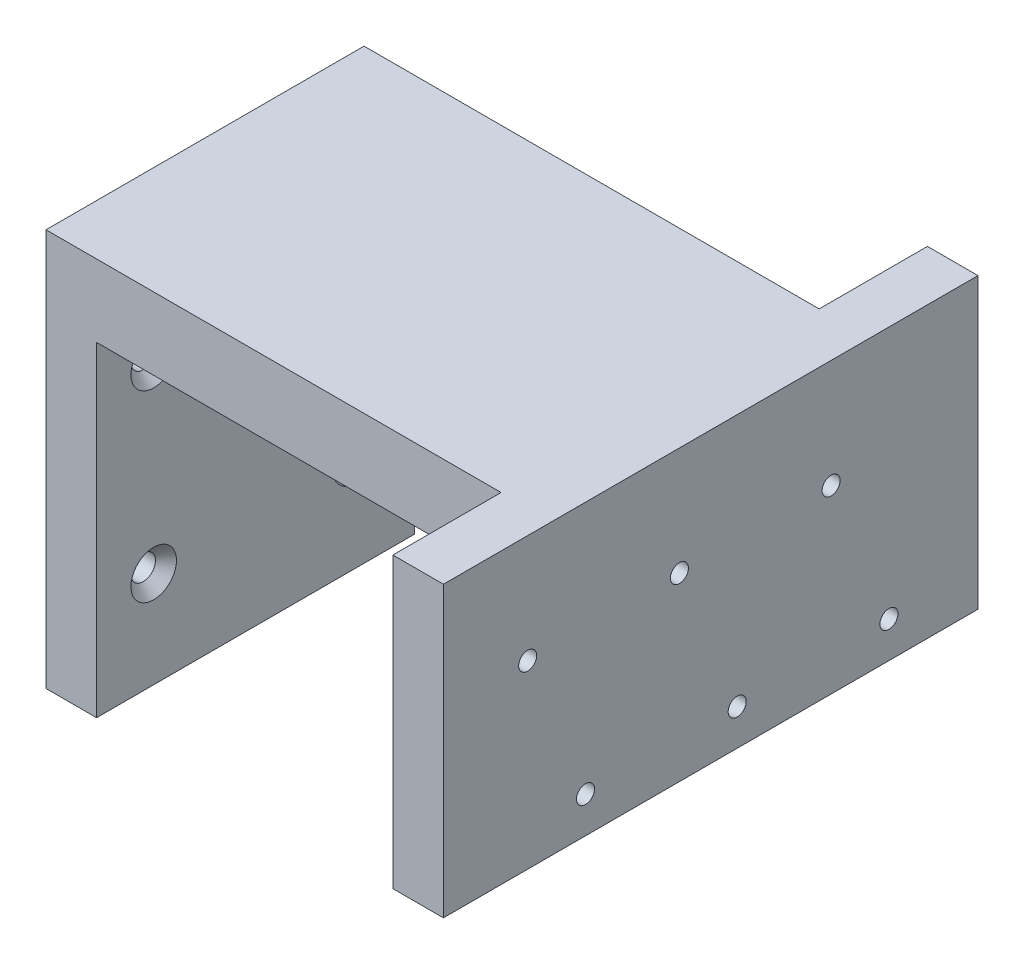
from build123d import *

# Parameters (mm, degrees)
SKETCH1_W                                           = 70
SKETCH1_H                                           = 55
BOSS_EXTRUDE1_DEPTH                                 = 74
CUT_EXTRUDE1_DEPTH                                  = 116.762688289
CUT_EXTRUDE1_DEPTH_BACK                             = 116.762688289
SKETCH4_R                                           = 1.25
CUT_EXTRUDE4_DEPTH                                  = 7
SKETCH5_W                                           = 14.985710671
SKETCH5_H                                           = 55
CUT_EXTRUDE5_DEPTH                                  = 63
CSK_FOR_M3_COUNTERSUNK_FLAT_HEAD_SCREW1_D           = 3.4
CSK_FOR_M3_COUNTERSUNK_FLAT_HEAD_SCREW1_DEPTH       = 10
CSK_FOR_M3_COUNTERSUNK_FLAT_HEAD_SCREW1_CSINK_D     = 6.3
CSK_FOR_M3_COUNTERSUNK_FLAT_HEAD_SCREW1_CSINK_ANGLE = 90
CSK_FOR_M3_COUNTERSUNK_FLAT_HEAD_SCREW1_TIP         = 1.021463052


with BuildPart() as part:
    # Sketch1 → Boss-Extrude1 (new body)
    with BuildSketch(Plane.XY):
        with Locations((35, 27.5)):
            Rectangle(SKETCH1_W, SKETCH1_H)
    extrude(amount=BOSS_EXTRUDE1_DEPTH)

    # Sketch2 → Cut-Extrude1 (cut, two sides: drawn at the far end of the back side and taken through both)
    with BuildSketch(Plane.XY.offset(74).offset(-CUT_EXTRUDE1_DEPTH_BACK)):
        Polygon((7, 0), (7, 45), (63, 45), (63, 15), (70, 15), (70, 0), (60, 0), align=None)
    extrude(amount=CUT_EXTRUDE1_DEPTH + CUT_EXTRUDE1_DEPTH_BACK, mode=Mode.SUBTRACT)

    # Sketch4 → Cut-Extrude4 (cut)
    with BuildSketch(Plane(origin=(70, 0, 0), x_dir=(0, 0, -1), z_dir=(1, 0, 0))):
        with Locations((-83.331764561, 40)):
            Circle(SKETCH4_R)
        with Locations((-75.331764561, 20)):
            Circle(SKETCH4_R)
        with Locations(Location((-62.331764561, 40, 0), (0, 0, 90))):
            Circle(SKETCH4_R)
        with Locations(Location((-54.331764561, 20, 0), (0, 0, 90))):
            Circle(SKETCH4_R)
        with Locations(Location((-41.331764561, 40, 0), (0, 0, 90))):
            Circle(SKETCH4_R)
        with Locations(Location((-33.331764561, 20, 0), (0, 0, 90))):
            Circle(SKETCH4_R)
        with Locations(Location((-20.331764561, 40, 0), (0, 0, 90))):
            Circle(SKETCH4_R)
        with Locations(Location((-12.331764561, 20, 0), (0, 0, 90))):
            Circle(SKETCH4_R)
    extrude(amount=-CUT_EXTRUDE4_DEPTH, mode=Mode.SUBTRACT)

    # Sketch5 → Cut-Extrude5 (cut)
    with BuildSketch(Plane.ZY):
        with Locations((7.492855336, 27.5)):
            Rectangle(SKETCH5_W, SKETCH5_H)
        with Locations((66.507144665, 27.5)):
            Rectangle(SKETCH5_W, SKETCH5_H)
    extrude(amount=-CUT_EXTRUDE5_DEPTH, mode=Mode.SUBTRACT)

    # CSK for M3 Countersunk Flat Head Screw1
    with Locations(Plane(origin=(7, 0, 0), x_dir=(0, 0, 1), z_dir=(1, 0, 0))):
        with Locations((23.167654473, -38.739261213), (23.167654473, -13.339261213), (51.107654473, -13.339261213), (51.107654473, -38.739261213)):
            CounterSinkHole(CSK_FOR_M3_COUNTERSUNK_FLAT_HEAD_SCREW1_D / 2, CSK_FOR_M3_COUNTERSUNK_FLAT_HEAD_SCREW1_CSINK_D / 2, depth=CSK_FOR_M3_COUNTERSUNK_FLAT_HEAD_SCREW1_DEPTH, counter_sink_angle=CSK_FOR_M3_COUNTERSUNK_FLAT_HEAD_SCREW1_CSINK_ANGLE)
            with Locations((0, 0, -(CSK_FOR_M3_COUNTERSUNK_FLAT_HEAD_SCREW1_DEPTH + CSK_FOR_M3_COUNTERSUNK_FLAT_HEAD_SCREW1_TIP / 2))):  # 118° drill point
                Cone(0, CSK_FOR_M3_COUNTERSUNK_FLAT_HEAD_SCREW1_D / 2, CSK_FOR_M3_COUNTERSUNK_FLAT_HEAD_SCREW1_TIP, mode=Mode.SUBTRACT)


solid = part.part
